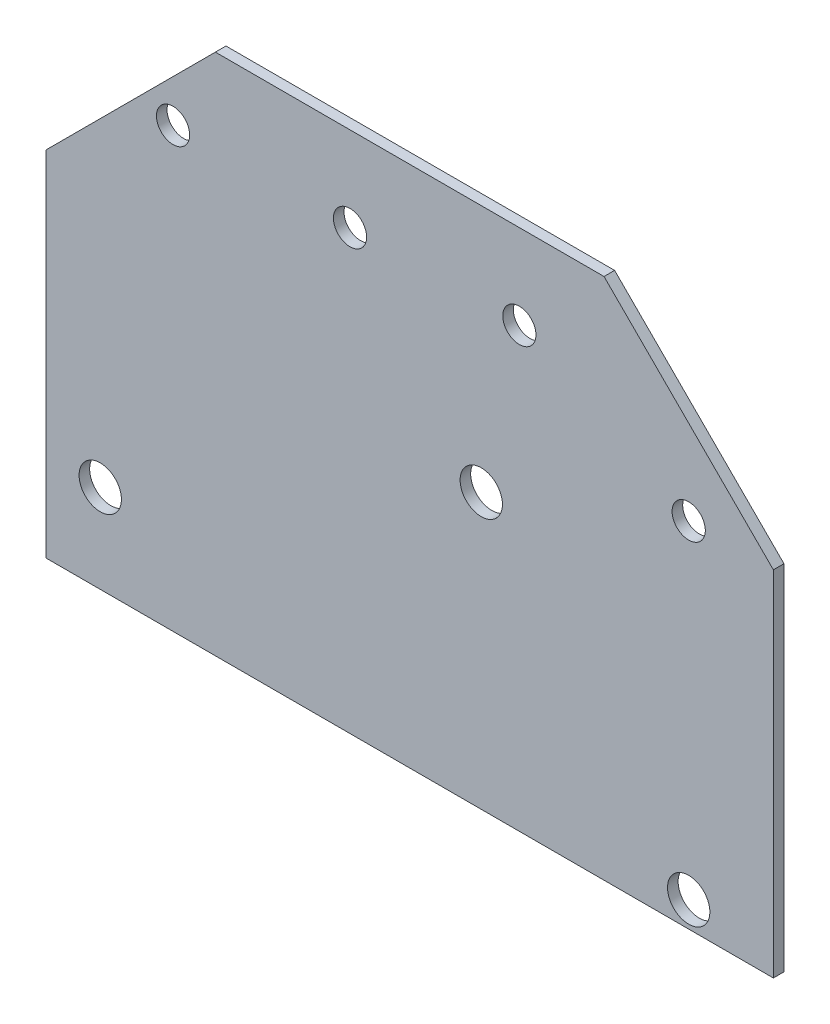
from build123d import *

# Parameters (mm, degrees)
BOSS_EXTRUDE1_DEPTH         = 1.5875
F_10_CLEARANCE_HOLE1_D      = 4.9784
F_1_4_0_25_DIAMETER_HOLE1_D = 6.35
F_1_4_0_25_DIAMETER_HOLE2_D = 6.35


with BuildPart() as part:
    # Sketch1 → Boss-Extrude1 (new body)
    with BuildSketch(Plane.XY):
        Polygon((233.807000506, -12.7), (233.807000506, -65.7225), (342.900001016, -65.7225), (342.900001016, -12.7), (317.500001016, 12.7), (259.207000506, 12.7), align=None)
    extrude(amount=BOSS_EXTRUDE1_DEPTH)

    # #10 Clearance Hole1 (through all)
    with Locations(Plane(origin=(0, 0, 0), x_dir=(-1, 0, 0), z_dir=(0, 0, -1))):
        with Locations((-330.199999492, -12.7), (-304.799999492, 0), (-279.399999492, 0), (-252.857001004, -8e-09)):
            Hole(F_10_CLEARANCE_HOLE1_D / 2)

    # 1/4 (0.25) Diameter Hole1 (through all)
    with Locations(Plane(origin=(0, 0, 0), x_dir=(-1, 0, 0), z_dir=(0, 0, -1))):
        with Locations((-330.200001016, -61.9125)):
            Hole(F_1_4_0_25_DIAMETER_HOLE1_D / 2)

    # 1/4 (0.25) Diameter Hole2 (through all)
    with Locations(Plane.XY.offset(1.5875)):
        with Locations((299.085001016, -24.525188452), (241.935001016, -52.465188452)):
            Hole(F_1_4_0_25_DIAMETER_HOLE2_D / 2)


solid = part.part
